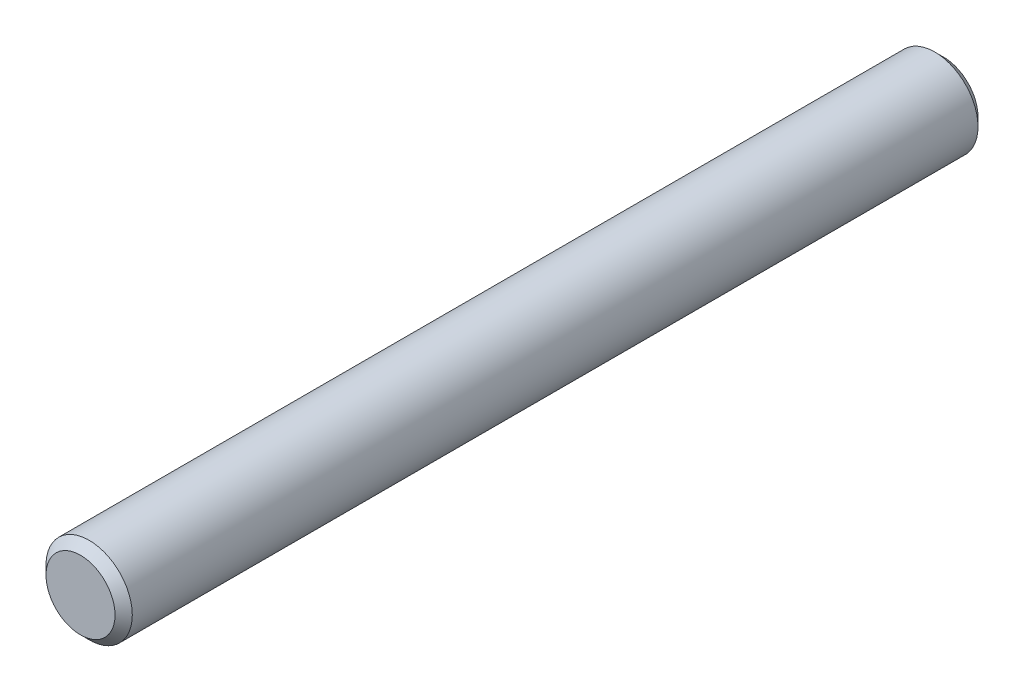
from build123d import *

# Parameters (mm, degrees)
SKIZZE1_R                       = 2.5
AUFSATZ_LINEAR_AUSTRAGEN1_DEPTH = 50
FASE1_SIZE                      = 0.5


with BuildPart() as part:
    # Skizze1 → Aufsatz-Linear austragen1 (new body)
    with BuildSketch(Plane.XY):
        Circle(SKIZZE1_R)
    extrude(amount=AUFSATZ_LINEAR_AUSTRAGEN1_DEPTH)

    # Fase1
    fase1_edges = [part.edges().sort_by_distance(p)[0] for p in [
        (-2.5, 0, 0),
        (-2.5, 0, 50),
    ]]
    chamfer(fase1_edges, length=FASE1_SIZE)


solid = part.part
